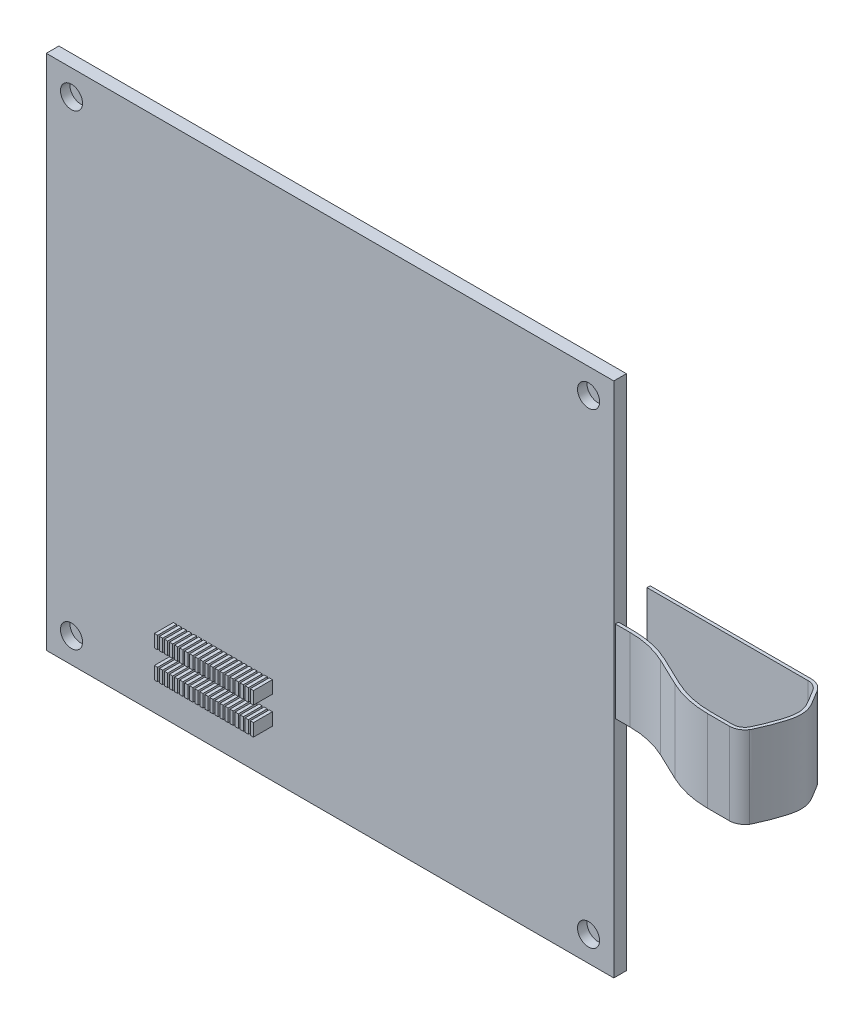
from build123d import *

# Parameters (mm, degrees)
ESQUISSE1_W             = 90
ESQUISSE1_H             = 82
BASE_EXTRUSION_DEPTH    = 2
ESQUISSE2_R             = 1.75
ENL_V_MAT_EXTRU_1_DEPTH = 1.5
ESQUISSE3_W             = 0.5
ESQUISSE3_H             = 2
BOSS_EXTRU_1_DEPTH      = 3
EXTRUSION1_DEPTH        = 6.5
EXTRUSION1_DEPTH_BACK   = 6.5


with BuildPart() as part:
    # Esquisse1 → Base-Extrusion (new body)
    with BuildSketch(Plane.XY):
        with Locations((45, 41)):
            Rectangle(ESQUISSE1_W, ESQUISSE1_H)
    extrude(amount=-BASE_EXTRUSION_DEPTH)

    # Esquisse2 → Enlèv. mat.-Extru.1 (cut)
    with BuildSketch(Plane.XY):
        with Locations((4, 78)):
            Circle(ESQUISSE2_R)
        with Locations((86, 78)):
            Circle(ESQUISSE2_R)
        with Locations((86, 4)):
            Circle(ESQUISSE2_R)
        with Locations((4, 4)):
            Circle(ESQUISSE2_R)
    extrude(amount=-ENL_V_MAT_EXTRU_1_DEPTH, mode=Mode.SUBTRACT)

    # Esquisse3 → Boss.-Extru.1 (add)
    with BuildSketch(Plane.XY):
        with Locations((20.4, 12.9)):
            Rectangle(ESQUISSE3_W, ESQUISSE3_H)
        with Locations((20.4, 8.5)):
            Rectangle(ESQUISSE3_W, ESQUISSE3_H)
        with Locations((21.2, 12.9)):
            Rectangle(ESQUISSE3_W, ESQUISSE3_H)
        with Locations((21.2, 8.5)):
            Rectangle(ESQUISSE3_W, ESQUISSE3_H)
        with Locations((22, 12.9)):
            Rectangle(ESQUISSE3_W, ESQUISSE3_H)
        with Locations((22, 8.5)):
            Rectangle(ESQUISSE3_W, ESQUISSE3_H)
        with Locations((22.8, 12.9)):
            Rectangle(ESQUISSE3_W, ESQUISSE3_H)
        with Locations((22.8, 8.5)):
            Rectangle(ESQUISSE3_W, ESQUISSE3_H)
        with Locations((23.6, 12.9)):
            Rectangle(ESQUISSE3_W, ESQUISSE3_H)
        with Locations((23.6, 8.5)):
            Rectangle(ESQUISSE3_W, ESQUISSE3_H)
        with Locations((24.4, 12.9)):
            Rectangle(ESQUISSE3_W, ESQUISSE3_H)
        with Locations((24.4, 8.5)):
            Rectangle(ESQUISSE3_W, ESQUISSE3_H)
        with Locations((25.2, 12.9)):
            Rectangle(ESQUISSE3_W, ESQUISSE3_H)
        with Locations((25.2, 8.5)):
            Rectangle(ESQUISSE3_W, ESQUISSE3_H)
        with Locations((26, 12.9)):
            Rectangle(ESQUISSE3_W, ESQUISSE3_H)
        with Locations((26, 8.5)):
            Rectangle(ESQUISSE3_W, ESQUISSE3_H)
        with Locations((26.8, 12.9)):
            Rectangle(ESQUISSE3_W, ESQUISSE3_H)
        with Locations((26.8, 8.5)):
            Rectangle(ESQUISSE3_W, ESQUISSE3_H)
        with Locations((27.6, 12.9)):
            Rectangle(ESQUISSE3_W, ESQUISSE3_H)
        with Locations((27.6, 8.5)):
            Rectangle(ESQUISSE3_W, ESQUISSE3_H)
        with Locations((28.4, 12.9)):
            Rectangle(ESQUISSE3_W, ESQUISSE3_H)
        with Locations((28.4, 8.5)):
            Rectangle(ESQUISSE3_W, ESQUISSE3_H)
        with Locations((29.2, 12.9)):
            Rectangle(ESQUISSE3_W, ESQUISSE3_H)
        with Locations((29.2, 8.5)):
            Rectangle(ESQUISSE3_W, ESQUISSE3_H)
        with Locations((30, 12.9)):
            Rectangle(ESQUISSE3_W, ESQUISSE3_H)
        with Locations((30, 8.5)):
            Rectangle(ESQUISSE3_W, ESQUISSE3_H)
        with Locations((30.8, 12.9)):
            Rectangle(ESQUISSE3_W, ESQUISSE3_H)
        with Locations((30.8, 8.5)):
            Rectangle(ESQUISSE3_W, ESQUISSE3_H)
        with Locations((31.6, 12.9)):
            Rectangle(ESQUISSE3_W, ESQUISSE3_H)
        with Locations((31.6, 8.5)):
            Rectangle(ESQUISSE3_W, ESQUISSE3_H)
        with Locations((32.4, 12.9)):
            Rectangle(ESQUISSE3_W, ESQUISSE3_H)
        with Locations((32.4, 8.5)):
            Rectangle(ESQUISSE3_W, ESQUISSE3_H)
        with Locations((33.2, 12.9)):
            Rectangle(ESQUISSE3_W, ESQUISSE3_H)
        with Locations((33.2, 8.5)):
            Rectangle(ESQUISSE3_W, ESQUISSE3_H)
        with Locations((34, 12.9)):
            Rectangle(ESQUISSE3_W, ESQUISSE3_H)
        with Locations((34, 8.5)):
            Rectangle(ESQUISSE3_W, ESQUISSE3_H)
        with Locations((34.8, 12.9)):
            Rectangle(ESQUISSE3_W, ESQUISSE3_H)
        with Locations((34.8, 8.5)):
            Rectangle(ESQUISSE3_W, ESQUISSE3_H)
        with Locations((35.6, 12.9)):
            Rectangle(ESQUISSE3_W, ESQUISSE3_H)
        with Locations((35.6, 8.5)):
            Rectangle(ESQUISSE3_W, ESQUISSE3_H)
    extrude(amount=BOSS_EXTRU_1_DEPTH)

    # Esquisse5 → Extrusion1 (add, two sides: drawn at the far end of the back side and taken through both)
    with BuildSketch(Plane.XZ.offset(-42).offset(-EXTRUSION1_DEPTH_BACK)):
        with BuildLine():
            Line((113.064228666, 4.25), (109.60413819, 4.25))
            ThreePointArc((109.60413819, 4.25), (106.284414478, 3.878035906), (103.129333169, 2.780591264))
            Line((103.129333169, 2.780591264), (98.822019173, 0.719408736))
            ThreePointArc((98.822019173, 0.719408736), (95.666937864, -0.378035906), (92.347214152, -0.75))
            Line((92.347214152, -0.75), (90, -0.75))
            Line((90, -0.75), (90, -0.25))
            Line((90, -0.25), (92.347214152, -0.25))
            ThreePointArc((92.347214152, -0.25), (95.556280407, 0.109565291), (98.606192339, 1.170428445))
            Line((98.606192339, 1.170428445), (102.913506335, 3.231610972))
            ThreePointArc((102.913506335, 3.231610972), (106.173757021, 4.365637103), (109.60413819, 4.75))
            Line((109.60413819, 4.75), (113.064228666, 4.75))
            ThreePointArc((113.064228666, 4.75), (114.244392406, 4.453908698), (115.14500717, 3.635770838))
            add(Edge.make_bspline(
                [(115.14500717, 3.635770838), (115.156612003, 3.623052283), (115.182464533, 3.590596537), (115.197091142, 3.568022465), (115.21389805, 3.541236939), (115.226759274, 3.516861249), (115.25230278, 3.46821826), (115.32094944, 3.32737289), (115.486369273, 2.973307146), (115.760325718, 2.352900431), (116.183924665, 1.333002656), (116.741105367, -0.173755919), (117.19160346, -1.943816366), (117.160604039, -3.368308275), (116.722241097, -4.567438341), (116.155898114, -5.492246732), (115.643215482, -6.299671343), (115.355623765, -6.772959226), (115.221454434, -7.00428755)],
                knots=[0.110984979, 0.110984979, 0.110984979, 0.110984979, 0.112559134, 0.11413329, 0.1172816, 0.123578222, 0.136171464, 0.161357949, 0.21173092, 0.26210389, 0.31247686, 0.413222801, 0.513968741, 0.614714682, 0.715460622, 0.816206563, 0.866579533, 0.916952503, 0.916952503, 0.916952503, 0.916952503], degree=3))
            ThreePointArc((115.221454434, -7.00428755), (114.306726393, -7.916300865), (113.05887201, -8.25))
            Line((113.05887201, -8.25), (87.513386684, -8.25))
            Line((87.513386684, -8.25), (87.513386684, -7.75))
            Line((87.513386684, -7.75), (113.05887201, -7.75))
            ThreePointArc((113.05887201, -7.75), (114.057155517, -7.483040692), (114.788937949, -6.75343004))
            add(Edge.make_bspline(
                [(114.790426851, 3.260069218), (114.599385864, 3.698390734), (117.877621233, -3.000833448), (115.987071542, -4.687665575), (114.788937949, -6.75343004)],
                knots=[0.08338151, 0.08338151, 0.08338151, 0.08338151, 0.50039214, 0.916952503, 0.916952503, 0.916952503, 0.916952503], degree=3))
            ThreePointArc((114.790426851, 3.260069218), (114.059181319, 3.984955106), (113.064228666, 4.25))
        make_face()
    extrude(amount=EXTRUSION1_DEPTH + EXTRUSION1_DEPTH_BACK)


solid = part.part
